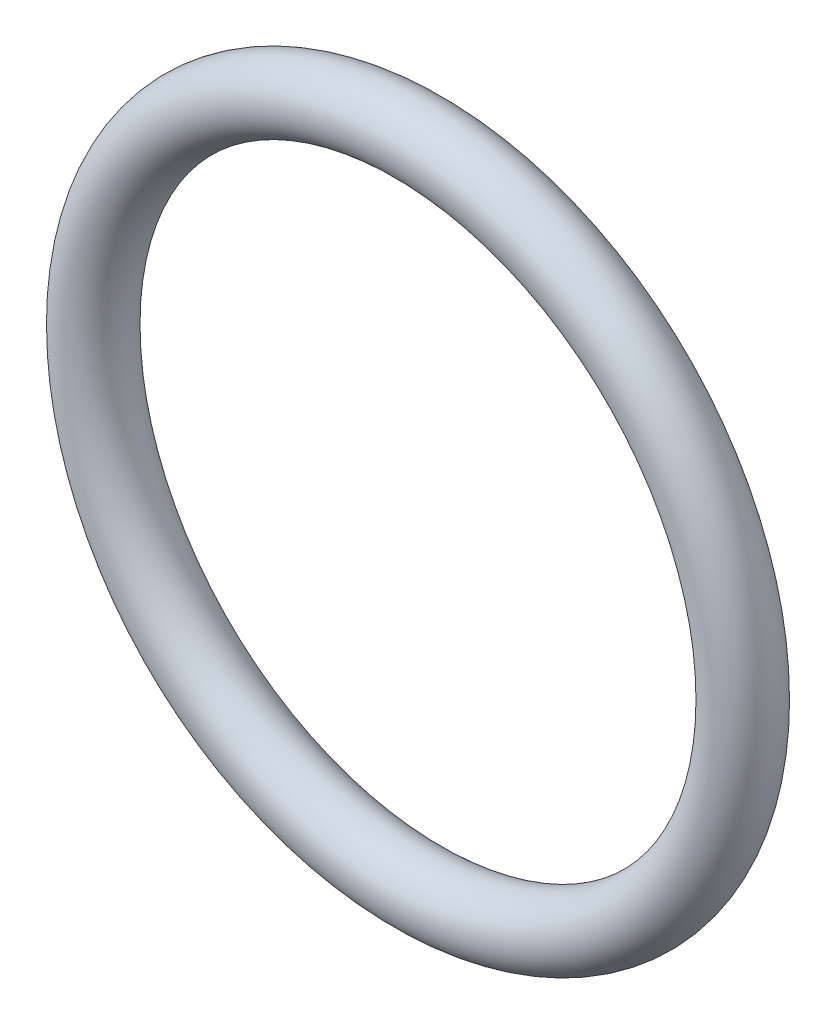
from build123d import *

# Parameters (mm, degrees)
SKETCH1_R = 0.8


with BuildPart() as part:
    # Sketch1 → Revolve1 (revolve)
    with BuildSketch(Plane(origin=(0, 0, 0), x_dir=(0, 0, -1), z_dir=(1, 0, 0)), mode=Mode.PRIVATE) as revolve1_sk:
        with Locations((0, 7.85)):
            Circle(SKETCH1_R)
    revolve(revolve1_sk.sketch.rotate(Axis((0, 0, 0.88), (0, 0, -1)), 90), axis=Axis((0, 0, 0.88), (0, 0, -1)))


solid = part.part
